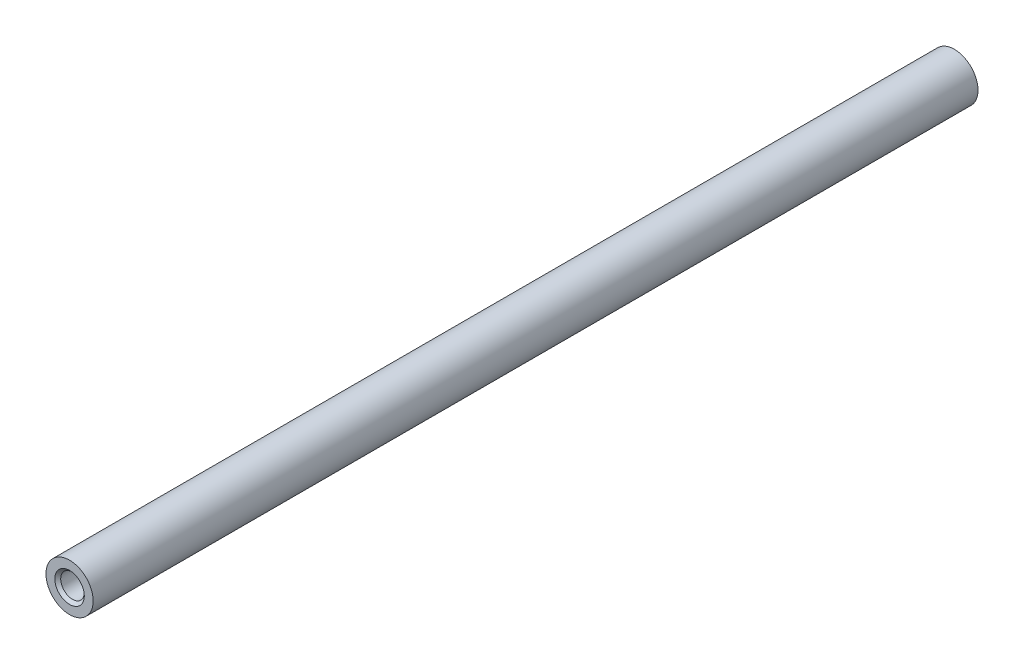
from build123d import *

# Parameters (mm, degrees)
SZKIC1_R                    = 8
SZKIC1_R_2                  = 4
DODANIE_WYCI_GNI_CIE1_DEPTH = 150
SZKIC2_R                    = 5
WYTNIJ_WYCI_GNI_CIE1_DEPTH  = 30
SFAZOWANIE1_SIZE            = 1


with BuildPart() as part:
    # Szkic1 → Dodanie-wyciągnięcie1 (new, symmetric)
    with BuildSketch(Plane.XY):
        Circle(SZKIC1_R)
        Circle(SZKIC1_R_2, mode=Mode.SUBTRACT)
    extrude(amount=DODANIE_WYCI_GNI_CIE1_DEPTH, both=True)

    # Szkic2 → Wytnij-wyciągnięcie1 (cut)
    with BuildSketch(Plane(origin=(0, 0, -150), x_dir=(-1, 0, 0), z_dir=(0, 0, -1))):
        Circle(SZKIC2_R)
    extrude(amount=-WYTNIJ_WYCI_GNI_CIE1_DEPTH, mode=Mode.SUBTRACT)

    # Sfazowanie1
    sfazowanie1_edges = [part.edges().sort_by_distance(p)[0] for p in [
        (-4, 0, 150),
    ]]
    chamfer(sfazowanie1_edges, length=SFAZOWANIE1_SIZE)


solid = part.part
